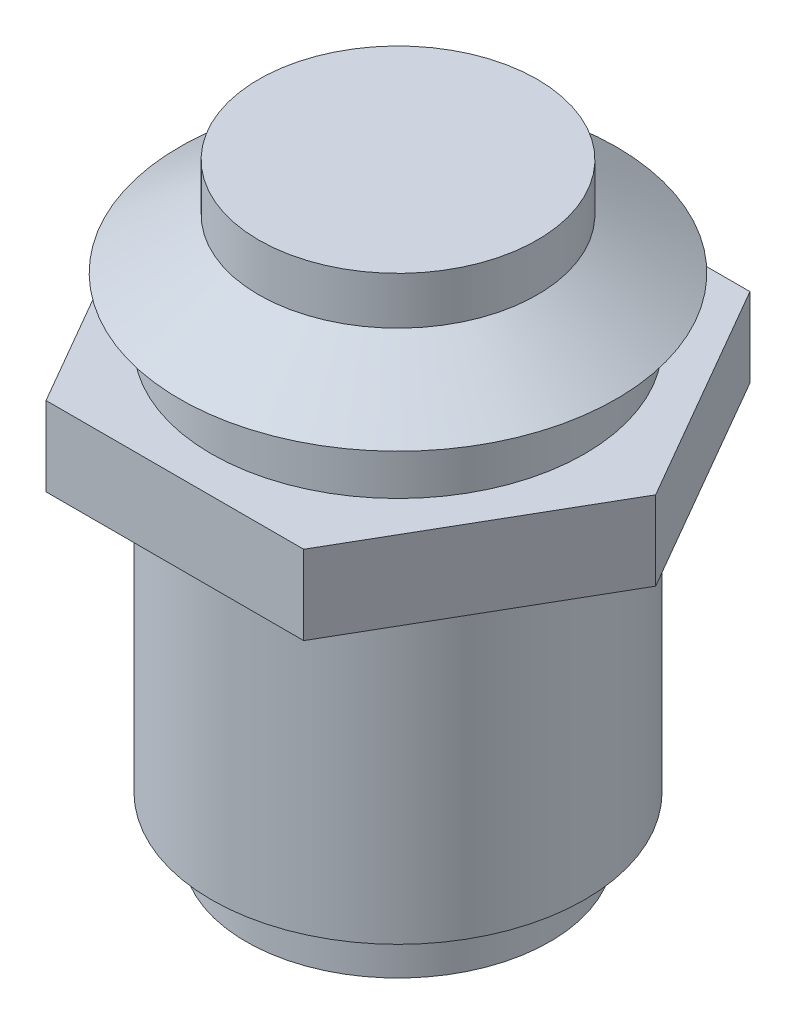
from build123d import *

# Parameters (mm, degrees)
BOSS_EXTRUDE1_DEPTH = 2.5


with BuildPart() as part:
    # Sketch1 → Revolve1 (revolve)
    with BuildSketch(Plane(origin=(0, 0, 0), x_dir=(0, 0, -1), z_dir=(1, 0, 0))):
        Polygon((0, 0), (0, 19), (4.4, 19), (4.4, 17.5), (6.9, 15.9), (5.9, 15.9), (5.9, 1.7), (4.8, 1.7), (4.8, 0), align=None)
    revolve(axis=Axis((0, 0, 0), (0, 1, 0)))


with BuildPart() as body_2:
    # Sketch2 → Boss-Extrude1 (new body)
    with BuildSketch(Plane.XZ.offset(-13.9)):
        Polygon((-4.070319398, -7.05), (4.070319398, -7.05), (8.140638796, 0), (4.070319398, 7.05), (-4.070319398, 7.05), (-8.140638796, 0), align=None)
    extrude(amount=BOSS_EXTRUDE1_DEPTH)


solid = Compound([part.part, body_2.part])
